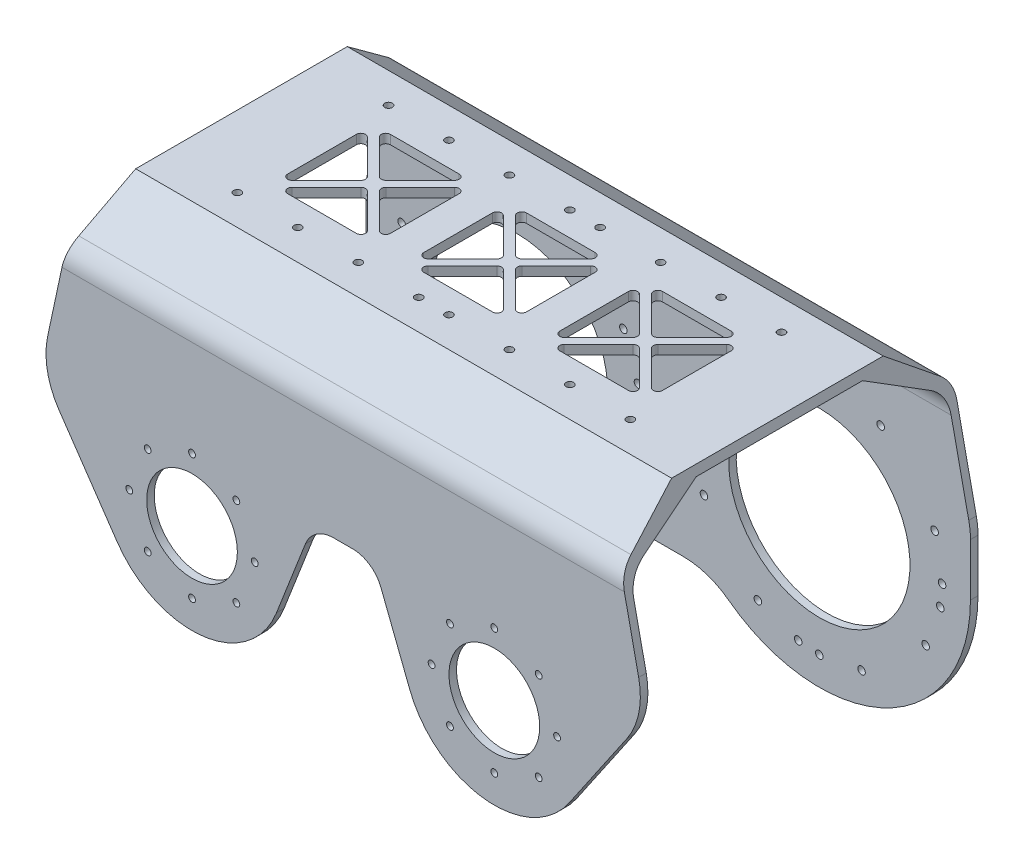
from build123d import *

# Parameters (mm, degrees)
SKETCH_1_R               = 60
EXTRUDE_1_DEPTH          = 220
CUT_EXTRUDE_1_DEPTH      = 348.56294394
CUT_EXTRUDE_1_DEPTH_BACK = 348.56294394
CUT_EXTRUDE_2_DEPTH      = 348.56294394
CUT_EXTRUDE_2_DEPTH_BACK = 348.56294394
SKETCH_4_R               = 2.5
CUT_EXTRUDE_3_DEPTH      = 32.5
EXTRUDE_START            = -5
SKETCH_5_R               = 60
SKETCH_5_R_2             = 30
EXTRUDE_2_DEPTH          = 5
SKETCH_6_R               = 2.25
CUT_EXTRUDE_4_DEPTH      = 5
CUT_EXTRUDE_START        = -10
CUT_EXTRUDE_5_DEPTH      = 10
CUT_EXTRUDE_6_DEPTH      = 381
FILLET_1_R               = 50
FILLET_2_R               = 20
SKETCH_9_W               = 413.093141703
SKETCH_9_H               = 93.42679847
CUT_EXTRUDE_7_DEPTH      = 381
SKETCH_10_R              = 2.5
CUT_EXTRUDE_8_DEPTH      = 10
FILLET_3_R               = 3


with BuildPart() as part:
    # 草图1 → 凸台-拉伸1 (new body)
    with BuildSketch(Plane.XY):
        with BuildLine():
            Line((200, 120), (200, 0))
            ThreePointArc((200, 0), (137.805896177, -92.578151927), (28.585715715, -70))
            Line((28.585715715, -70), (-28.585715715, -70))
            ThreePointArc((-28.585715715, -70), (-137.805896177, -92.578151927), (-200, 0))
            Line((-200, 0), (-200, 120))
            Line((-200, 120), (-200, 180))
            Line((-200, 180), (200, 180))
            Line((200, 180), (200, 120))
        make_face()
        with Locations((100, 0)):
            Circle(SKETCH_1_R, mode=Mode.SUBTRACT)
        with Locations(Location((-100, 0, 0), (0, 0, 180))):
            Circle(SKETCH_1_R, mode=Mode.SUBTRACT)
    extrude(amount=EXTRUDE_1_DEPTH)

    # 草图2 → 切除-拉伸1 (cut, two sides: drawn at the far end of the back side and taken through both)
    with BuildSketch(Plane(origin=(0, 0, 0), x_dir=(0, 0, -1), z_dir=(1, 0, 0)).offset(-CUT_EXTRUDE_1_DEPTH_BACK)):
        Polygon((-215, 111.132486541), (-215, -188.867513459), (-5, -188.867513459), (-5, 111.132486541), (-55, 140), (-165, 140), align=None)
    extrude(amount=CUT_EXTRUDE_1_DEPTH + CUT_EXTRUDE_1_DEPTH_BACK, mode=Mode.SUBTRACT)

    # 草图3 → 切除-拉伸2 (cut, two sides: drawn at the far end of the back side and taken through both)
    with BuildSketch(Plane(origin=(0, 0, 0), x_dir=(0, 0, -1), z_dir=(1, 0, 0)).offset(-CUT_EXTRUDE_2_DEPTH_BACK)):
        Polygon((-180, 180), (-180, 146), (-220, 115), (-220, 180), align=None)
        Polygon((0, 180), (-40, 180), (-40, 146), (0, 115), align=None)
    extrude(amount=CUT_EXTRUDE_2_DEPTH + CUT_EXTRUDE_2_DEPTH_BACK, mode=Mode.SUBTRACT)

    # 草图4 → 切除-拉伸3 (cut)
    with BuildSketch(Plane(origin=(0, 0, 0), x_dir=(-1, 0, 0), z_dir=(0, 0, -1))):
        with Locations((-72.051017301, 76.291656595)):
            Circle(SKETCH_4_R)
        with Locations((-100, 81.25)):
            Circle(SKETCH_4_R)
        with Locations((-113.94129927, 80.045004058)):
            Circle(SKETCH_4_R)
        with Locations((-140.625, 70.364564057)):
            Circle(SKETCH_4_R)
        with Locations((-23.708343405, -27.948982699)):
            Circle(SKETCH_4_R)
        with Locations((-18.75, 0)):
            Circle(SKETCH_4_R)
        with Locations((-19.954995942, 13.94129927)):
            Circle(SKETCH_4_R)
        with Locations((-29.635435943, 40.625)):
            Circle(SKETCH_4_R)
        with Locations((-127.948982699, -76.291656595)):
            Circle(SKETCH_4_R)
        with Locations((-100, -81.25)):
            Circle(SKETCH_4_R)
        with Locations((-86.05870073, -80.045004058)):
            Circle(SKETCH_4_R)
        with Locations((-59.375, -70.364564057)):
            Circle(SKETCH_4_R)
        with Locations((-176.291656595, 27.948982699)):
            Circle(SKETCH_4_R)
        with Locations((-181.25, 0)):
            Circle(SKETCH_4_R)
        with Locations((-180.045004058, -13.94129927)):
            Circle(SKETCH_4_R)
        with Locations((-170.364564057, -40.625)):
            Circle(SKETCH_4_R)
        with Locations(Location((170.364564057, -40.625, 0), (0, 0, 90))):
            Circle(SKETCH_4_R)
        with Locations(Location((180.045004058, -13.94129927, 0), (0, 0, 90))):
            Circle(SKETCH_4_R)
        with Locations(Location((181.25, 0, 0), (0, 0, 90))):
            Circle(SKETCH_4_R)
        with Locations(Location((176.291656595, 27.948982699, 0), (0, 0, 90))):
            Circle(SKETCH_4_R)
        with Locations(Location((59.375, -70.364564057, 0), (0, 0, 90))):
            Circle(SKETCH_4_R)
        with Locations(Location((86.05870073, -80.045004058, 0), (0, 0, 90))):
            Circle(SKETCH_4_R)
        with Locations(Location((100, -81.25, 0), (0, 0, 90))):
            Circle(SKETCH_4_R)
        with Locations(Location((127.948982699, -76.291656595, 0), (0, 0, 90))):
            Circle(SKETCH_4_R)
        with Locations(Location((29.635435943, 40.625, 0), (0, 0, 90))):
            Circle(SKETCH_4_R)
        with Locations(Location((19.954995942, 13.94129927, 0), (0, 0, 90))):
            Circle(SKETCH_4_R)
        with Locations(Location((18.75, 0, 0), (0, 0, 90))):
            Circle(SKETCH_4_R)
        with Locations(Location((23.708343405, -27.948982699, 0), (0, 0, 90))):
            Circle(SKETCH_4_R)
        with Locations(Location((140.625, 70.364564057, 0), (0, 0, 90))):
            Circle(SKETCH_4_R)
        with Locations(Location((113.94129927, 80.045004058, 0), (0, 0, 90))):
            Circle(SKETCH_4_R)
        with Locations(Location((100, 81.25, 0), (0, 0, 90))):
            Circle(SKETCH_4_R)
        with Locations(Location((72.051017301, 76.291656595, 0), (0, 0, 90))):
            Circle(SKETCH_4_R)
    extrude(amount=-CUT_EXTRUDE_3_DEPTH, mode=Mode.SUBTRACT)

    # 草图5 → 凸台-拉伸2 (add)
    # profile 1 of 2: a face of its own
    with BuildSketch(Plane.XY.offset(220).offset(EXTRUDE_START)):
        with Locations(Location((-100, 0, 0), (0, 0, 180))):
            Circle(SKETCH_5_R)
        with Locations((-100, 0)):
            Circle(SKETCH_5_R_2, mode=Mode.SUBTRACT)
    # profile 2 of 2: a face of its own
    with BuildSketch(Plane.XY.offset(220).offset(EXTRUDE_START)):
        with Locations(Location((100, 0, 0), (0, 0, 90))):
            Circle(SKETCH_5_R)
        with Locations((100, 0)):
            Circle(SKETCH_5_R_2, mode=Mode.SUBTRACT)
    extrude(amount=EXTRUDE_2_DEPTH)

    # 草图6 → 切除-拉伸4 (cut)
    with BuildSketch(Plane.XY.offset(220)):
        with Locations((100, 41.5)):
            Circle(SKETCH_6_R)
        with Locations((129.344931419, 29.344931419)):
            Circle(SKETCH_6_R)
        with Locations((141.5, 0)):
            Circle(SKETCH_6_R)
        with Locations((129.344931419, -29.344931419)):
            Circle(SKETCH_6_R)
        with Locations((100, -41.5)):
            Circle(SKETCH_6_R)
        with Locations((70.655068581, -29.344931419)):
            Circle(SKETCH_6_R)
        with Locations((58.5, 0)):
            Circle(SKETCH_6_R)
        with Locations((70.655068581, 29.344931419)):
            Circle(SKETCH_6_R)
        with Locations((-70.655068581, 29.344931419)):
            Circle(SKETCH_6_R)
        with Locations((-58.5, 0)):
            Circle(SKETCH_6_R)
        with Locations((-70.655068581, -29.344931419)):
            Circle(SKETCH_6_R)
        with Locations((-100, -41.5)):
            Circle(SKETCH_6_R)
        with Locations((-129.344931419, -29.344931419)):
            Circle(SKETCH_6_R)
        with Locations((-141.5, 0)):
            Circle(SKETCH_6_R)
        with Locations((-129.344931419, 29.344931419)):
            Circle(SKETCH_6_R)
        with Locations((-100, 41.5)):
            Circle(SKETCH_6_R)
    extrude(amount=-CUT_EXTRUDE_4_DEPTH, mode=Mode.SUBTRACT)

    # 草图7 → 切除-拉伸5 (cut)
    with BuildSketch(Plane.XY.offset(220).offset(CUT_EXTRUDE_START)):
        Polygon((183.928571429, 115), (200, 115), (200, 180), (170, 180), align=None)
        Polygon((183.928571429, 115), (200, 40), (200, 115), align=None)
        with BuildLine():
            Line((20, 40), (-20, 40))
            Line((-20, 40), (-44.100251258, -21.799497484))
            ThreePointArc((-44.100251258, -21.799497484), (-93.187236713, -59.611964037), (-149.539872917, -33.849682293))
            Line((-149.539872917, -33.849682293), (-200, 40))
            Line((-200, 40), (-200, 0))
            ThreePointArc((-200, 0), (-137.805896177, -92.578151927), (-28.585715715, -70))
            Line((-28.585715715, -70), (28.585715715, -70))
            ThreePointArc((28.585715715, -70), (137.805896177, -92.578151927), (200, 0))
            Line((200, 0), (200, 40))
            Line((200, 40), (149.539872917, -33.849682293))
            ThreePointArc((149.539872917, -33.849682293), (93.187236713, -59.611964037), (44.100251258, -21.799497484))
            Line((44.100251258, -21.799497484), (20, 40))
        make_face()
        Polygon((-200, 180), (-200, 115), (-183.928571429, 115), (-170, 180), align=None)
        Polygon((-200, 115), (-200, 40), (-183.928571429, 115), align=None)
    extrude(amount=CUT_EXTRUDE_5_DEPTH, mode=Mode.SUBTRACT)

    # 草图8 → 切除-拉伸6 (cut)
    with BuildSketch(Plane(origin=(0, 0, 0), x_dir=(-1, 0, 0), z_dir=(0, 0, -1))):
        Polygon((200, 40), (170, 180), (200, 180), align=None)
        Polygon((-200, 40), (-170, 180), (-200, 180), align=None)
    extrude(amount=-CUT_EXTRUDE_6_DEPTH, mode=Mode.SUBTRACT)

    # 圆角1
    fillet_1_edges = [part.edges().sort_by_distance(p)[0] for p in [
        (200, 40, 217.5),
        (-200, 40, 217.5),
        (28.585715715, -70, 2.5),
        (-28.585715715, -70, 2.5),
        (-200, 40, 2.5),
        (200, 40, 2.5),
    ]]
    fillet(fillet_1_edges, radius=FILLET_1_R)

    # 圆角2
    fillet_2_edges = [part.edges().sort_by_distance(p)[0] for p in [
        (0, 115, 220),
        (0, 111.132486541, 215),
        (-20, 40, 217.5),
        (20, 40, 217.5),
        (0, 115, 0),
        (0, 111.132486541, 5),
    ]]
    fillet(fillet_2_edges, radius=FILLET_2_R)

    # 草图9 → 切除-拉伸7 (cut)
    with BuildSketch(Plane.XY.offset(220)):
        with Locations((-29.260856566, 192.713399235)):
            Rectangle(SKETCH_9_W, SKETCH_9_H)
    extrude(amount=-CUT_EXTRUDE_7_DEPTH, mode=Mode.SUBTRACT)

    # 草图10 → 切除-拉伸8 (cut)
    with BuildSketch(Plane(origin=(0, 146, 0), x_dir=(1, 0, 0), z_dir=(0, 1, 0))):
        with Locations(Location((130, -60, 0), (0, 0, 270))):
            Circle(SKETCH_10_R)
        with Locations(Location((50, -60, 0), (0, 0, 270))):
            Circle(SKETCH_10_R)
        with Locations(Location((-50, -60, 0), (0, 0, 270))):
            Circle(SKETCH_10_R)
        with Locations(Location((-130, -60, 0), (0, 0, 270))):
            Circle(SKETCH_10_R)
        with Locations(Location((130, -160, 0), (0, 0, 270))):
            Circle(SKETCH_10_R)
        with Locations(Location((50, -160, 0), (0, 0, 270))):
            Circle(SKETCH_10_R)
        with Locations(Location((-50, -160, 0), (0, 0, 270))):
            Circle(SKETCH_10_R)
        with Locations(Location((-130, -160, 0), (0, 0, 270))):
            Circle(SKETCH_10_R)
        with Locations(Location((10, -60, 0), (0, 0, 270))):
            Circle(SKETCH_10_R)
        with Locations(Location((90, -60, 0), (0, 0, 270))):
            Circle(SKETCH_10_R)
        with Locations(Location((90, -160, 0), (0, 0, 270))):
            Circle(SKETCH_10_R)
        with Locations(Location((10, -160, 0), (0, 0, 270))):
            Circle(SKETCH_10_R)
        with Locations(Location((-90, -160, 0), (0, 0, 270))):
            Circle(SKETCH_10_R)
        with Locations(Location((-10, -160, 0), (0, 0, 270))):
            Circle(SKETCH_10_R)
        with Locations(Location((-90, -60, 0), (0, 0, 270))):
            Circle(SKETCH_10_R)
        with Locations(Location((-10, -60, 0), (0, 0, 270))):
            Circle(SKETCH_10_R)
        Polygon((60, -76), (120, -76), (90, -106), align=None)
        Polygon((94, -110), (124, -80), (124, -140), align=None)
        Polygon((90, -114), (120, -144), (60, -144), align=None)
        Polygon((86, -110), (56, -140), (56, -80), align=None)
        Polygon((4, -110), (34, -80), (34, -140), align=None)
        Polygon((0, -106), (-30, -76), (30, -76), align=None)
        Polygon((-4, -110), (-34, -140), (-34, -80), align=None)
        Polygon((0, -114), (30, -144), (-30, -144), align=None)
        Polygon((-86, -110), (-56, -80), (-56, -140), align=None)
        Polygon((-90, -106), (-120, -76), (-60, -76), align=None)
        Polygon((-94, -110), (-124, -140), (-124, -80), align=None)
        Polygon((-90, -114), (-60, -144), (-120, -144), align=None)
    extrude(amount=-CUT_EXTRUDE_8_DEPTH, mode=Mode.SUBTRACT)

    # 圆角3
    fillet_3_edges = [part.edges().sort_by_distance(p)[0] for p in [
        (120, 143, 144),
        (60, 143, 144),
        (90, 143, 114),
        (56, 143, 140),
        (56, 143, 80),
        (86, 143, 110),
        (124, 143, 80),
        (124, 143, 140),
        (94, 143, 110),
        (-30, 143, 76),
        (30, 143, 76),
        (0, 143, 106),
        (-120, 143, 76),
        (-60, 143, 76),
        (-90, 143, 106),
        (-34, 143, 140),
        (-34, 143, 80),
        (-4, 143, 110),
        (34, 143, 80),
        (34, 143, 140),
        (4, 143, 110),
        (30, 143, 144),
        (-30, 143, 144),
        (0, 143, 114),
        (90, 143, 106),
        (60, 143, 76),
        (120, 143, 76),
        (-124, 143, 140),
        (-124, 143, 80),
        (-94, 143, 110),
        (-56, 143, 80),
        (-56, 143, 140),
        (-86, 143, 110),
        (-60, 143, 144),
        (-120, 143, 144),
        (-90, 143, 114),
    ]]
    fillet(fillet_3_edges, radius=FILLET_3_R)


solid = part.part
